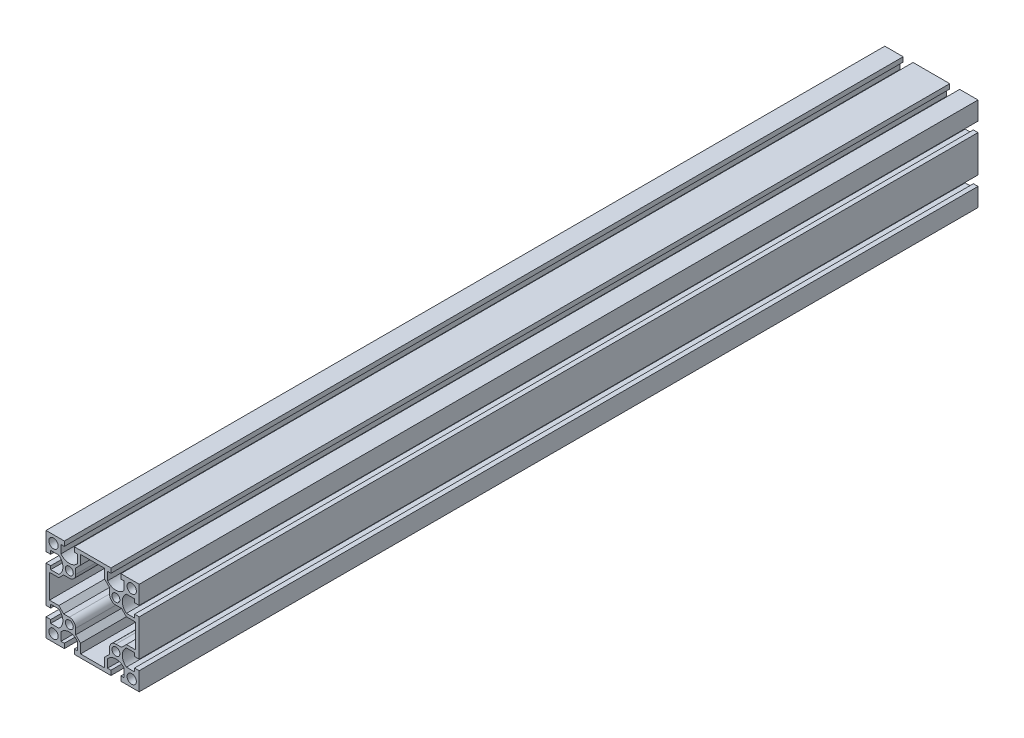
from build123d import *

# Parameters (mm, degrees)
SKETCH_1_R      = 3.4
SKETCH_1_R_2    = 4
EXTRUDE_1_DEPTH = 360


with BuildPart() as part:
    # 草图1 → 凸台-拉伸1 (new, symmetric)
    with BuildSketch(Plane.XY):
        with BuildLine():
            Line((-40, 40), (-24.25, 40))
            Line((-24.25, 40), (-24.25, 36))
            Line((-24.25, 36), (-27.15, 36))
            Line((-27.15, 36), (-27.15, 29))
            ThreePointArc((-27.15, 29), (-20, 25.5), (-12.85, 29))
            Line((-12.85, 29), (-12.85, 36))
            Line((-12.85, 36), (-15.75, 36))
            Line((-15.75, 36), (-15.75, 40))
            Line((-15.75, 40), (15.75, 40))
            Line((15.75, 40), (15.75, 36))
            Line((15.75, 36), (12.85, 36))
            Line((12.85, 36), (12.85, 29))
            ThreePointArc((12.85, 29), (20, 25.5), (27.15, 29))
            Line((27.15, 29), (27.15, 36))
            Line((27.15, 36), (24.25, 36))
            Line((24.25, 36), (24.25, 40))
            Line((24.25, 40), (40, 40))
            Line((40, 40), (40, 24.25))
            Line((40, 24.25), (36, 24.25))
            Line((36, 24.25), (36, 27.15))
            Line((36, 27.15), (29, 27.15))
            ThreePointArc((29, 27.15), (25.5, 20), (29, 12.85))
            Line((29, 12.85), (36, 12.85))
            Line((36, 12.85), (36, 15.75))
            Line((36, 15.75), (40.000271684, 15.75))
            Line((40.000271684, 15.75), (40.000271684, -15.75))
            Line((40.000271684, -15.75), (36, -15.75))
            Line((36, -15.75), (36, -12.85))
            Line((36, -12.85), (29, -12.85))
            ThreePointArc((29, -12.85), (25.5, -20), (29, -27.15))
            Line((29, -27.15), (36, -27.15))
            Line((36, -27.15), (36, -24.25))
            Line((36, -24.25), (40, -24.25))
            Line((40, -24.25), (40, -40))
            Line((40, -40), (24.25, -40))
            Line((24.25, -40), (24.25, -36))
            Line((24.25, -36), (27.15, -36))
            Line((27.15, -36), (27.15, -29))
            ThreePointArc((27.15, -29), (20, -25.5), (12.85, -29))
            Line((12.85, -29), (12.85, -36))
            Line((12.85, -36), (15.75, -36))
            Line((15.75, -36), (15.75, -40))
            Line((15.75, -40), (-15.75, -40))
            Line((-15.75, -40), (-15.75, -36))
            Line((-15.75, -36), (-12.85, -36))
            Line((-12.85, -36), (-12.85, -29))
            ThreePointArc((-12.85, -29), (-20, -25.5), (-27.15, -29))
            Line((-27.15, -29), (-27.15, -36))
            Line((-27.15, -36), (-24.25, -36))
            Line((-24.25, -36), (-24.25, -40))
            Line((-24.25, -40), (-40, -40))
            Line((-40, -40), (-40, -24.25))
            Line((-40, -24.25), (-36, -24.25))
            Line((-36, -24.25), (-36, -27.15))
            Line((-36, -27.15), (-29, -27.15))
            ThreePointArc((-29, -27.15), (-25.5, -20), (-29, -12.85))
            Line((-29, -12.85), (-36, -12.85))
            Line((-36, -12.85), (-36, -15.75))
            Line((-36, -15.75), (-40.000271684, -15.75))
            Line((-40.000271684, -15.75), (-40.000271684, 15.75))
            Line((-40.000271684, 15.75), (-36, 15.75))
            Line((-36, 15.75), (-36, 12.85))
            Line((-36, 12.85), (-29, 12.85))
            ThreePointArc((-29, 12.85), (-25.5, 20), (-29, 27.15))
            Line((-29, 27.15), (-36, 27.15))
            Line((-36, 27.15), (-36, 24.25))
            Line((-36, 24.25), (-40, 24.25))
            Line((-40, 24.25), (-40, 40))
        make_face()
        with Locations(Location((-20, 20, 0), (0, 0, 180))):
            Circle(SKETCH_1_R, mode=Mode.SUBTRACT)
        with Locations(Location((-33.575, 33.575, 0), (0, 0, 180))):
            Circle(SKETCH_1_R_2, mode=Mode.SUBTRACT)
        with Locations(Location((33.575, 33.575, 0), (0, 0, 180))):
            Circle(SKETCH_1_R_2, mode=Mode.SUBTRACT)
        with Locations(Location((20, 20, 0), (0, 0, 180))):
            Circle(SKETCH_1_R, mode=Mode.SUBTRACT)
        with Locations(Location((20, -20, 0), (0, 0, 180))):
            Circle(SKETCH_1_R, mode=Mode.SUBTRACT)
        with Locations(Location((33.575, -33.575, 0), (0, 0, 180))):
            Circle(SKETCH_1_R_2, mode=Mode.SUBTRACT)
        with Locations(Location((-33.575, -33.575, 0), (0, 0, 180))):
            Circle(SKETCH_1_R_2, mode=Mode.SUBTRACT)
        with Locations(Location((-20, -20, 0), (0, 0, 180))):
            Circle(SKETCH_1_R, mode=Mode.SUBTRACT)
        with BuildLine():
            Line((10.35, 37), (-10.35, 37))
            Line((-10.35, 37), (-10.35, 29))
            Line((-10.35, 29), (-14.5, 24.85))
            Line((-14.5, 24.85), (-14.5, 20))
            ThreePointArc((-14.5, 20), (-16.110912703, 16.110912703), (-20, 14.5))
            Line((-20, 14.5), (-24.85, 14.5))
            Line((-24.85, 14.5), (-29, 10.35))
            Line((-29, 10.35), (-37, 10.35))
            Line((-37, 10.35), (-37, -10.35))
            Line((-37, -10.35), (-29, -10.35))
            Line((-29, -10.35), (-24.85, -14.5))
            Line((-24.85, -14.5), (-20, -14.5))
            ThreePointArc((-20, -14.5), (-16.110912703, -16.110912703), (-14.5, -20))
            Line((-14.5, -20), (-14.5, -24.85))
            Line((-14.5, -24.85), (-10.35, -29))
            Line((-10.35, -29), (-10.35, -37))
            Line((-10.35, -37), (10.35, -37))
            Line((10.35, -37), (10.35, -29))
            Line((10.35, -29), (14.5, -24.85))
            Line((14.5, -24.85), (14.5, -20))
            ThreePointArc((14.5, -20), (16.110912703, -16.110912703), (20, -14.5))
            Line((20, -14.5), (24.85, -14.5))
            Line((24.85, -14.5), (29, -10.35))
            Line((29, -10.35), (37, -10.35))
            Line((37, -10.35), (37, 10.35))
            Line((37, 10.35), (29, 10.35))
            Line((29, 10.35), (24.85, 14.5))
            Line((24.85, 14.5), (20, 14.5))
            ThreePointArc((20, 14.5), (16.110912703, 16.110912703), (14.5, 20))
            Line((14.5, 20), (14.5, 24.85))
            Line((14.5, 24.85), (10.35, 29))
            Line((10.35, 29), (10.35, 37))
        make_face(mode=Mode.SUBTRACT)
    extrude(amount=EXTRUDE_1_DEPTH, both=True)


solid = part.part
